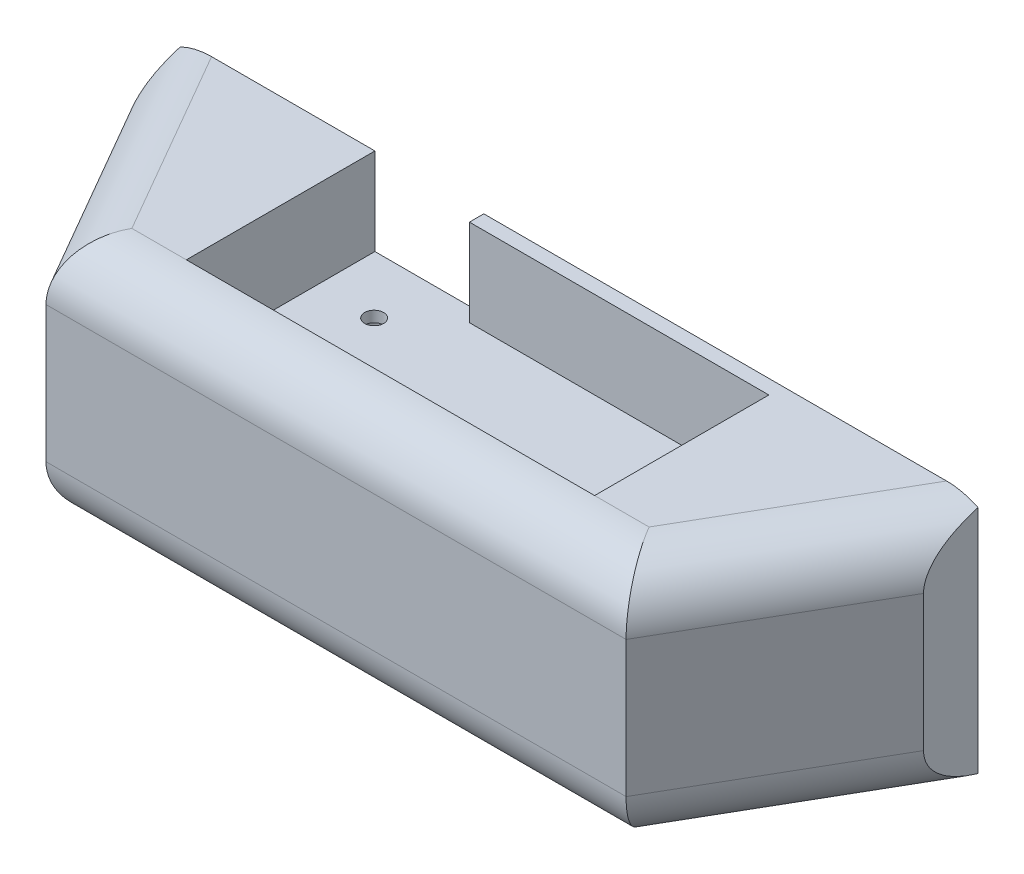
from build123d import *

# Parameters (mm, degrees)
BOSS_EXTRUDE2_DEPTH = 45
FILLET2_R           = 10
FILLET3_R           = 10
SKETCH6_R           = 1.5
CUT_EXTRUDE5_DEPTH  = 10
SKETCH7_R           = 1.5
CUT_EXTRUDE6_DEPTH  = 10
CUT_EXTRUDE7_DEPTH  = 27
SKETCH3_W           = 75
SKETCH3_H           = 32
CUT_EXTRUDE8_DEPTH  = 16
SKETCH11_R          = 1.75
CUT_EXTRUDE9_DEPTH  = 20
SKETCH12_W          = 20
SKETCH12_H          = 2.641016152
CUT_EXTRUDE11_DEPTH = 16


with BuildPart() as part:
    # Sketch2 → Boss-Extrude2 (new body)
    with BuildSketch(Plane(origin=(0, 0, 0), x_dir=(1, 0, 0), z_dir=(0, 1, 0))):
        Polygon((-73.275, 22.320508076), (73.275, 22.320508076), (73.275, 12.320508076), (53.275, -22.320508076), (-53.275, -22.320508076), (-73.275, 12.320508076), align=None)
    extrude(amount=BOSS_EXTRUDE2_DEPTH)

    # Fillet2
    fillet2_edges = [part.edges().sort_by_distance(p)[0] for p in [
        (63.275, 45, 5),
        (0, 45, 22.320508076),
        (-63.275, 45, 5),
    ]]
    fillet(fillet2_edges, radius=FILLET2_R)

    # Fillet3
    fillet3_edges = [part.edges().sort_by_distance(p)[0] for p in [
        (-63.275, 0, 5),
        (63.275, 0, 5),
        (0, 0, 22.320508076),
    ]]
    fillet(fillet3_edges, radius=FILLET3_R)

    # Sketch6 → Cut-Extrude5 (cut)
    with BuildSketch(Plane(origin=(0, 0, 0), x_dir=(-1, 0, 0), z_dir=(0, -1, 0))):
        with Locations(Location((40, -2.320508076, 0), (0, 0, 90))):
            Circle(SKETCH6_R)
        with Locations(Location((-40, -2.320508076, 0), (0, 0, 270))):
            Circle(SKETCH6_R)
        with Locations(Location((60, 17.679491924, 0), (0, 0, 90))):
            Circle(SKETCH6_R)
        with Locations(Location((-60, 17.679491924, 0), (0, 0, 270))):
            Circle(SKETCH6_R)
    extrude(amount=-CUT_EXTRUDE5_DEPTH, mode=Mode.SUBTRACT)

    # Sketch7 → Cut-Extrude6 (cut)
    with BuildSketch(Plane(origin=(0, 0, 0), x_dir=(-1, 0, 0), z_dir=(0, -1, 0))):
        with Locations(Location((40, 7.679491924, 0), (0, 0, 90))):
            Circle(SKETCH7_R)
        with Locations(Location((-40, 7.679491924, 0), (0, 0, 270))):
            Circle(SKETCH7_R)
    extrude(amount=-CUT_EXTRUDE6_DEPTH, mode=Mode.SUBTRACT)

    # Sketch9 → Cut-Extrude7 (cut)
    with BuildSketch(Plane(origin=(0, 0, 0), x_dir=(-1, 0, 0), z_dir=(0, -1, 0))):
        with BuildLine():
            Line((27, 7.179491924), (23.574350468, 7.179491924))
            ThreePointArc((23.574350468, 7.179491924), (0, -12.320508076), (-23.574350468, 7.179491924))
            Line((-23.574350468, 7.179491924), (-27, 7.179491924))
            ThreePointArc((-27, 7.179491924), (-31.5, 11.679491924), (-27, 16.179491924))
            Line((-27, 16.179491924), (-23.574350468, 16.179491924))
            ThreePointArc((-23.574350468, 16.179491924), (0, 35.679491924), (23.574350468, 16.179491924))
            Line((23.574350468, 16.179491924), (27, 16.179491924))
            ThreePointArc((27, 16.179491924), (31.5, 11.679491924), (27, 7.179491924))
        make_face()
    extrude(amount=-CUT_EXTRUDE7_DEPTH, mode=Mode.SUBTRACT)

    # Sketch3 → Cut-Extrude8 (cut)
    with BuildSketch(Plane(origin=(0, 45, 0), x_dir=(1, 0, 0), z_dir=(0, 1, 0))):
        with Locations((0, 3.679491924)):
            Rectangle(SKETCH3_W, SKETCH3_H)
    extrude(amount=-CUT_EXTRUDE8_DEPTH, mode=Mode.SUBTRACT)

    # Sketch11 → Cut-Extrude9 (cut)
    with BuildSketch(Plane(origin=(0, 29, 0), x_dir=(1, 0, 0), z_dir=(0, 1, 0))):
        with Locations(Location((27, 11.679491924, 0), (0, 0, 270))):
            Circle(SKETCH11_R)
        with Locations(Location((-27, 11.679491924, 0), (0, 0, 90))):
            Circle(SKETCH11_R)
    extrude(amount=-CUT_EXTRUDE9_DEPTH, mode=Mode.SUBTRACT)

    # Sketch12 → Cut-Extrude11 (cut)
    with BuildSketch(Plane(origin=(0, 45, 0), x_dir=(1, 0, 0), z_dir=(0, 1, 0))):
        with Locations((-27.5, 21)):
            Rectangle(SKETCH12_W, SKETCH12_H)
    extrude(amount=-CUT_EXTRUDE11_DEPTH, mode=Mode.SUBTRACT)


solid = part.part
